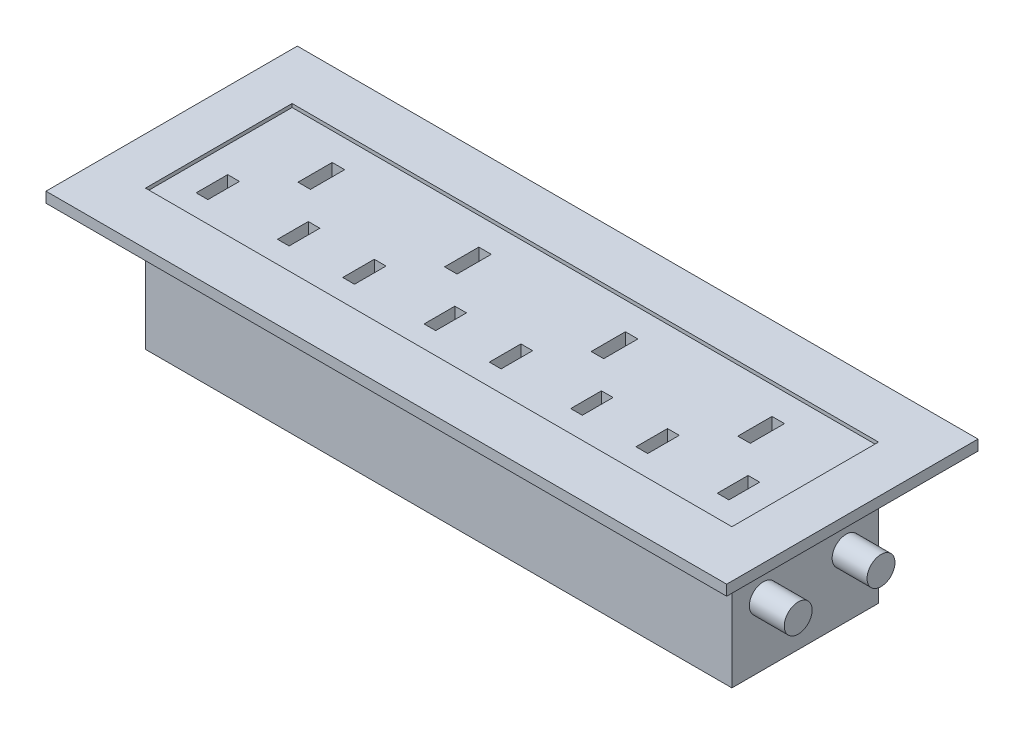
from build123d import *

# Parameters (mm, degrees)
SKETCH_1_W          = 195
SKETCH_1_H          = 72
EXTRUDE_1_DEPTH     = 3
SKETCH_2_W          = 168
SKETCH_2_H          = 42
EXTRUDE_2_DEPTH     = 40
SKETCH_2_2_W        = 168
SKETCH_2_2_H        = 42
CUT_EXTRUDE_1_DEPTH = 1
SKETCH_3_R          = 4
EXTRUDE_3_DEPTH     = 10
SKETCH_4_R          = 4
EXTRUDE_4_DEPTH     = 10
SKETCH_7_W          = 3.370643822
SKETCH_7_H          = 9.043190742
CUT_EXTRUDE_2_DEPTH = 25
SKETCH_6_W          = 3.579680374
SKETCH_6_H          = 9.801505786
CUT_EXTRUDE_3_DEPTH = 25
SKETCH_8_W          = 3.328212
SKETCH_8_H          = 8.8197618
CUT_EXTRUDE_4_DEPTH = 25


with BuildPart() as part:
    # 草图1 → 凸台-拉伸1 (new body)
    with BuildSketch(Plane(origin=(0, 0, 0), x_dir=(1, 0, 0), z_dir=(0, 1, 0))):
        Rectangle(SKETCH_1_W, SKETCH_1_H)
    extrude(amount=EXTRUDE_1_DEPTH)

    # 草图2 → 凸台-拉伸2 (add)
    with BuildSketch(Plane(origin=(0, 3, 0), x_dir=(1, 0, 0), z_dir=(0, 1, 0))):
        Rectangle(SKETCH_2_W, SKETCH_2_H)
    extrude(amount=-EXTRUDE_2_DEPTH)

    # 草图2<2> → 切除-拉伸1 (cut)
    with BuildSketch(Plane(origin=(0, 3, 0), x_dir=(1, 0, 0), z_dir=(0, 1, 0))):
        Rectangle(SKETCH_2_2_W, SKETCH_2_2_H)
    extrude(amount=-CUT_EXTRUDE_1_DEPTH, mode=Mode.SUBTRACT)

    # 草图3 → 凸台-拉伸3 (add)
    with BuildSketch(Plane(origin=(84, 0, 0), x_dir=(0, 0, -1), z_dir=(1, 0, 0))):
        with Locations((-12.009379944, -19.151607151)):
            Circle(SKETCH_3_R)
    extrude(amount=EXTRUDE_3_DEPTH)

    # 草图4 → 凸台-拉伸4 (add)
    with BuildSketch(Plane(origin=(84, 0, 0), x_dir=(0, 0, -1), z_dir=(1, 0, 0))):
        with Locations((11.71568974, -19.228280966)):
            Circle(SKETCH_4_R)
    extrude(amount=EXTRUDE_4_DEPTH)

    # 草图7 → 切除-拉伸2 (cut)
    with BuildSketch(Plane(origin=(0, 2, 0), x_dir=(1, 0, 0), z_dir=(0, 1, 0))):
        with Locations((-32.896346176, -9.388907812)):
            Rectangle(SKETCH_7_W, SKETCH_7_H)
        with Locations((-74.896346176, -9.388907812)):
            Rectangle(SKETCH_7_W, SKETCH_7_H)
        with Locations((9.103653824, -9.388907812)):
            Rectangle(SKETCH_7_W, SKETCH_7_H)
        with Locations((51.103653824, -9.388907812)):
            Rectangle(SKETCH_7_W, SKETCH_7_H)
    extrude(amount=-CUT_EXTRUDE_2_DEPTH, mode=Mode.SUBTRACT)

    # 草图6 → 切除-拉伸3 (cut)
    with BuildSketch(Plane(origin=(0, 2, 0), x_dir=(1, 0, 0), z_dir=(0, 1, 0))):
        with Locations((-20.841650073, 8.216489042)):
            Rectangle(SKETCH_6_W, SKETCH_6_H)
        with Locations((-62.841650073, 8.216489042)):
            Rectangle(SKETCH_6_W, SKETCH_6_H)
        with Locations((21.158349927, 8.216489042)):
            Rectangle(SKETCH_6_W, SKETCH_6_H)
        with Locations((63.158349927, 8.216489042)):
            Rectangle(SKETCH_6_W, SKETCH_6_H)
    extrude(amount=-CUT_EXTRUDE_3_DEPTH, mode=Mode.SUBTRACT)

    # 草图8 → 切除-拉伸4 (cut)
    with BuildSketch(Plane(origin=(0, 2, 0), x_dir=(1, 0, 0), z_dir=(0, 1, 0))):
        with Locations((-9.739053762, -9.375255868)):
            Rectangle(SKETCH_8_W, SKETCH_8_H)
        with Locations((-51.739053762, -9.375255868)):
            Rectangle(SKETCH_8_W, SKETCH_8_H)
        with Locations((32.260946238, -9.375255868)):
            Rectangle(SKETCH_8_W, SKETCH_8_H)
        with Locations((74.260946238, -9.375255868)):
            Rectangle(SKETCH_8_W, SKETCH_8_H)
    extrude(amount=-CUT_EXTRUDE_4_DEPTH, mode=Mode.SUBTRACT)


solid = part.part
